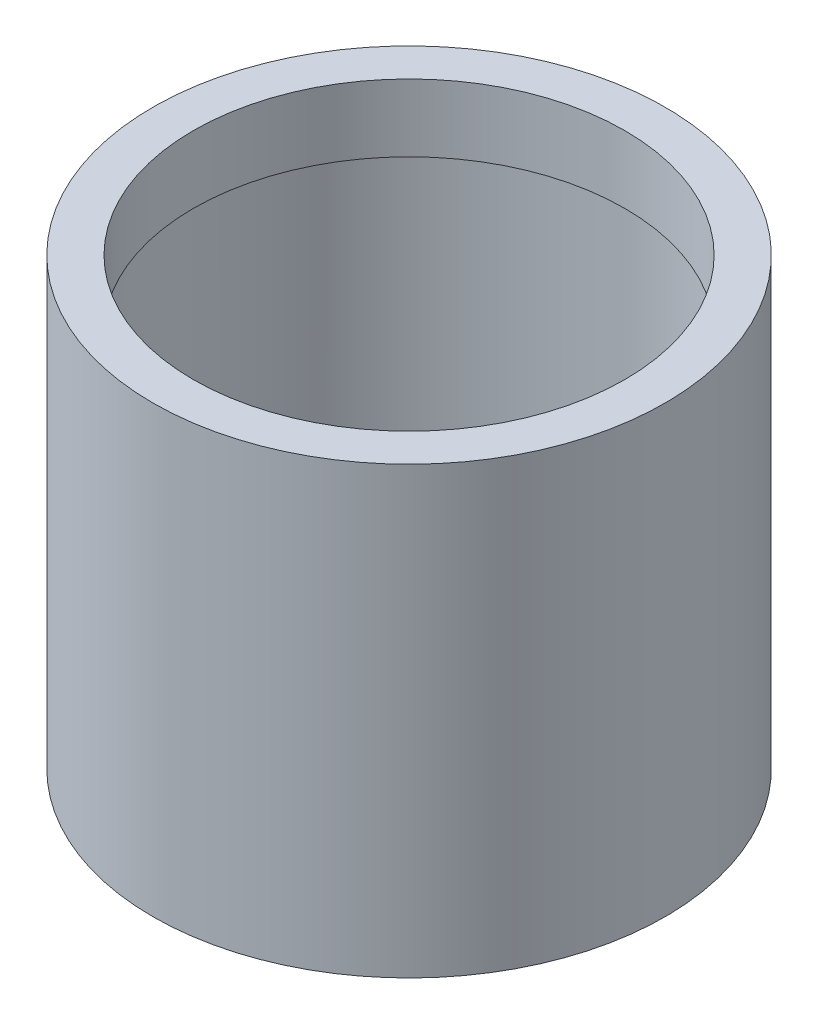
from build123d import *

# Parameters (mm, degrees)
SKETCH1_R           = 19
BOSS_EXTRUDE1_DEPTH = 33
SKETCH2_R           = 16
CUT_EXTRUDE1_DEPTH  = 5
SKETCH3_R           = 17.5
CUT_EXTRUDE2_DEPTH  = 28


with BuildPart() as part:
    # Sketch1 → Boss-Extrude1 (new body)
    with BuildSketch(Plane(origin=(0, 0, 0), x_dir=(1, 0, 0), z_dir=(0, 1, 0))):
        with Locations(Location((0, 0, 0), (0, 0, 270))):
            Circle(SKETCH1_R)
    extrude(amount=BOSS_EXTRUDE1_DEPTH)

    # Sketch2 → Cut-Extrude1 (cut)
    with BuildSketch(Plane(origin=(0, 33, 0), x_dir=(1, 0, 0), z_dir=(0, 1, 0))):
        with Locations(Location((0, 0, 0), (0, 0, 270))):
            Circle(SKETCH2_R)
    extrude(amount=-CUT_EXTRUDE1_DEPTH, mode=Mode.SUBTRACT)

    # Sketch3 → Cut-Extrude2 (cut)
    with BuildSketch(Plane.XZ):
        with Locations(Location((0, 0, 0), (0, 0, 270))):
            Circle(SKETCH3_R)
    extrude(amount=-CUT_EXTRUDE2_DEPTH, mode=Mode.SUBTRACT)


solid = part.part
